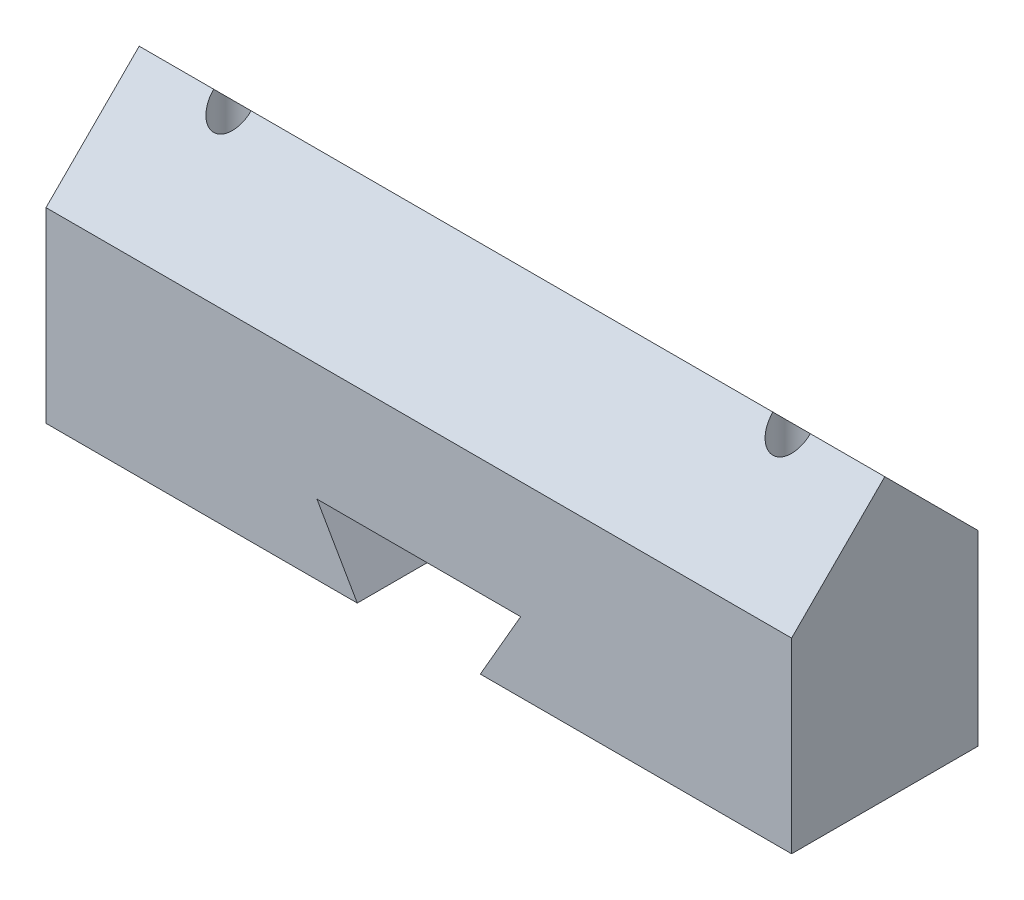
from build123d import *

# Parameters (mm, degrees)
BOSS_EXTRUDE1_DEPTH         = 25.4
CUT_EXTRUDE1_DEPTH          = 112.462737913
F_1_4_20_TAPPED_HOLE1_D     = 5.1054
F_1_4_20_TAPPED_HOLE1_DEPTH = 16.51
F_1_4_20_TAPPED_HOLE1_TIP   = 1.533816902


with BuildPart() as part:
    # Sketch1 → Boss-Extrude1 (new body)
    with BuildSketch(Plane.XY):
        Polygon((0, 0), (-5.499261314, 9.525), (22.263261314, 9.525), (16.764, 0), (59.182, 0), (59.182, 38.16047619), (-42.418, 38.16047619), (-42.418, 0), align=None)
    extrude(amount=BOSS_EXTRUDE1_DEPTH)

    # Sketch2 → Cut-Extrude1 (cut, through all)
    with BuildSketch(Plane.ZY.offset(42.418)):
        Polygon((0, 38.16047619), (0, 25.46047619), (12.7, 38.16047619), align=None)
        Polygon((25.4, 38.16047619), (12.7, 38.16047619), (25.4, 25.46047619), align=None)
    extrude(amount=-CUT_EXTRUDE1_DEPTH, mode=Mode.SUBTRACT)

    # 1/4-20 Tapped Hole1
    with Locations(Plane(origin=(0, 38.16047619, 0), x_dir=(-1, 0, 0), z_dir=(0, 1, 0))):
        with Locations((29.718, 12.7), (-46.482, 12.7)):
            Hole(F_1_4_20_TAPPED_HOLE1_D / 2, depth=F_1_4_20_TAPPED_HOLE1_DEPTH)
            with Locations((0, 0, -(F_1_4_20_TAPPED_HOLE1_DEPTH + F_1_4_20_TAPPED_HOLE1_TIP / 2))):  # 118° drill point
                Cone(0, F_1_4_20_TAPPED_HOLE1_D / 2, F_1_4_20_TAPPED_HOLE1_TIP, mode=Mode.SUBTRACT)


solid = part.part
